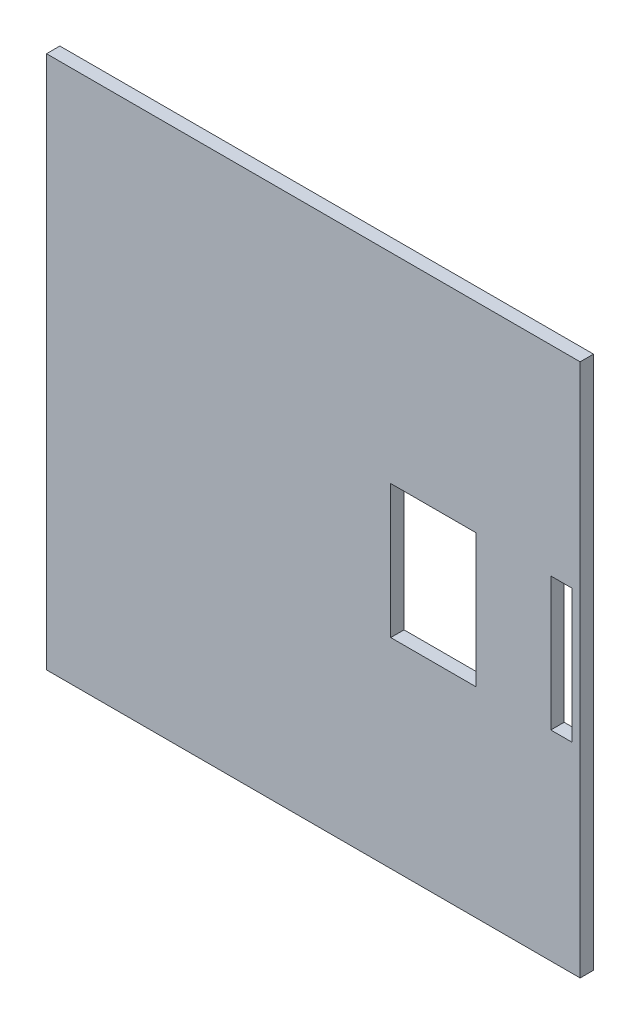
from build123d import *

# Parameters (mm, degrees)
ESQUISSE1_W             = 200
ESQUISSE1_H             = 200
BOSS_EXTRU_1_DEPTH      = 5
ESQUISSE2_W             = 8
ESQUISSE2_H             = 50
ENL_V_MAT_EXTRU_1_DEPTH = 5
ESQUISSE3_W             = 32
ESQUISSE3_H             = 50
ENL_V_MAT_EXTRU_2_DEPTH = 5


with BuildPart() as part:
    # Esquisse1 → Boss.-Extru.1 (new body)
    with BuildSketch(Plane.XY):
        with Locations((100, 100)):
            Rectangle(ESQUISSE1_W, ESQUISSE1_H)
    extrude(amount=BOSS_EXTRU_1_DEPTH)

    # Esquisse2 → Enlèv. mat.-Extru.1 (cut)
    with BuildSketch(Plane.XY.offset(5)):
        with Locations((193, 100)):
            Rectangle(ESQUISSE2_W, ESQUISSE2_H)
    extrude(amount=-ENL_V_MAT_EXTRU_1_DEPTH, mode=Mode.SUBTRACT)

    # Esquisse3 → Enlèv. mat.-Extru.2 (cut)
    with BuildSketch(Plane.XY.offset(5)):
        with Locations((145, 100)):
            Rectangle(ESQUISSE3_W, ESQUISSE3_H)
    extrude(amount=-ENL_V_MAT_EXTRU_2_DEPTH, mode=Mode.SUBTRACT)


solid = part.part
